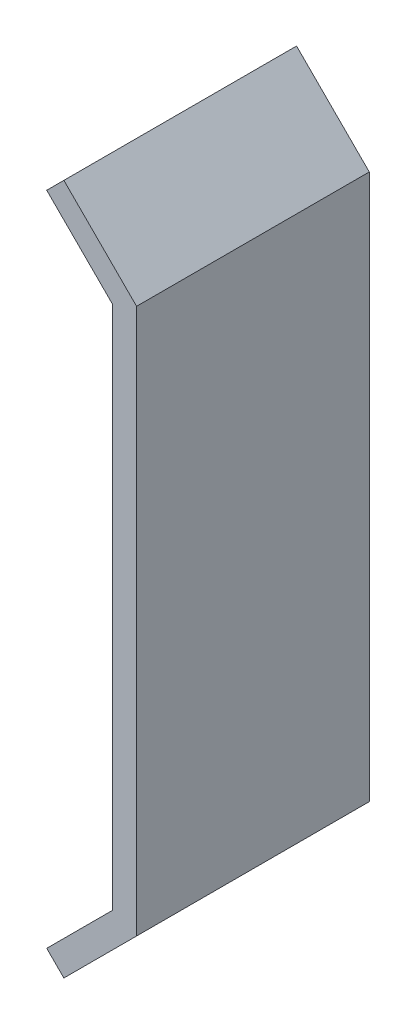
from build123d import *

# Parameters (mm, degrees)
EXTRUDE_1_DEPTH     = 1.6
EXTRUDE_2_DEPTH     = 8
CUT_EXTRUDE_1_DEPTH = 8


with BuildPart() as part:
    # 草图1 → 凸台-拉伸1 (new body)
    with BuildSketch(Plane.XY):
        Polygon((0, 0), (-3, 3), (-3, 25.5), (0, 28.5), (3, 25.5), (3, 3), align=None)
    extrude(amount=EXTRUDE_1_DEPTH)

    # 草图2 → 凸台-拉伸2 (add)
    with BuildSketch(Plane.XY.offset(1.6)):
        Polygon((0, 0), (3, 3), (3, 25.5), (0, 28.5), (-3, 25.5), (-3, 3), align=None)
        Polygon((0, 1.414213562), (2, 3.414213562), (2, 25.085786438), (0, 27.085786438), (-2, 25.085786438), (-2, 3.414213562), align=None, mode=Mode.SUBTRACT)
    extrude(amount=EXTRUDE_2_DEPTH)

    # 草图3 → 切除-拉伸1 (cut)
    with BuildSketch(Plane.XY.offset(9.6)):
        Polygon((0, 27.085786438), (-0.707106781, 27.792893219), (-3, 25.5), (-3, 3), (-0.707106781, 0.707106781), (0, 1.414213562), (-2, 3.414213562), (-2, 25.085786438), align=None)
    extrude(amount=-CUT_EXTRUDE_1_DEPTH, mode=Mode.SUBTRACT)


solid = part.part
